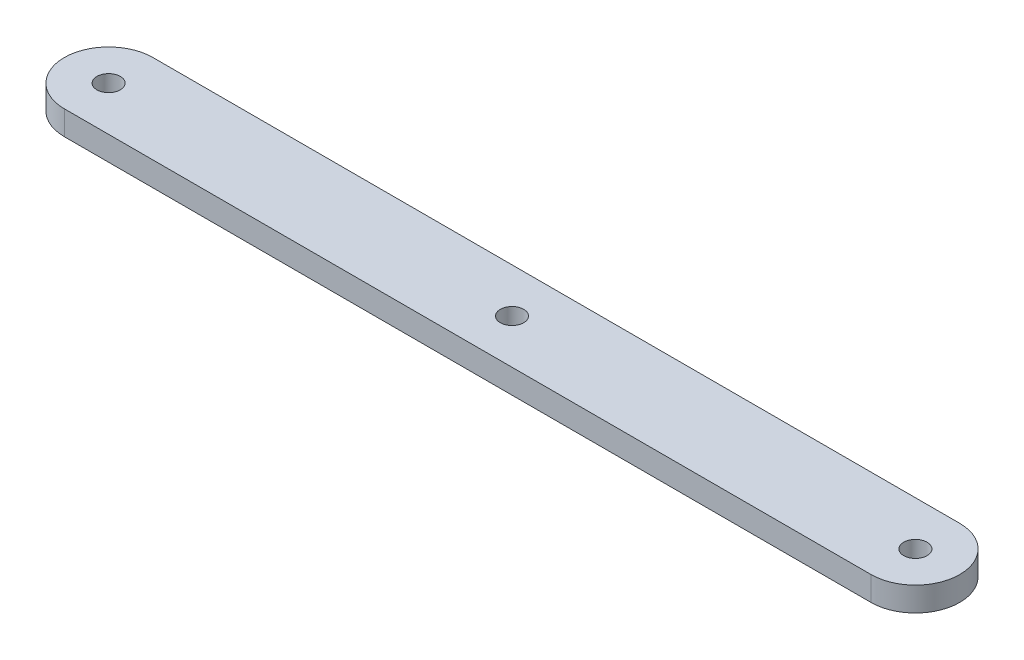
from build123d import *

# Parameters (mm, degrees)
SKETCH1_R           = 2.1
BOSS_EXTRUDE1_DEPTH = 4.35


with BuildPart() as part:
    # Sketch1 → Boss-Extrude1 (new body)
    with BuildSketch(Plane(origin=(0, 0, 0), x_dir=(1, 0, 0), z_dir=(0, 1, 0))):
        with BuildLine():
            Line((0, 7.973476097), (145.04, 7.973476097))
            ThreePointArc((145.04, 7.973476097), (153.013476097, 0), (145.04, -7.973476097))
            Line((145.04, -7.973476097), (0, -7.973476097))
            ThreePointArc((0, -7.973476097), (-7.973476097, 0), (0, 7.973476097))
        make_face()
        with Locations(Location((145.04, 0, 0), (0, 0, 270))):
            Circle(SKETCH1_R, mode=Mode.SUBTRACT)
        with Locations(Location((72.52, 0, 0), (0, 0, 270))):
            Circle(SKETCH1_R, mode=Mode.SUBTRACT)
        with Locations(Location((0, 0, 0), (0, 0, 270))):
            Circle(SKETCH1_R, mode=Mode.SUBTRACT)
    extrude(amount=BOSS_EXTRUDE1_DEPTH)


solid = part.part
